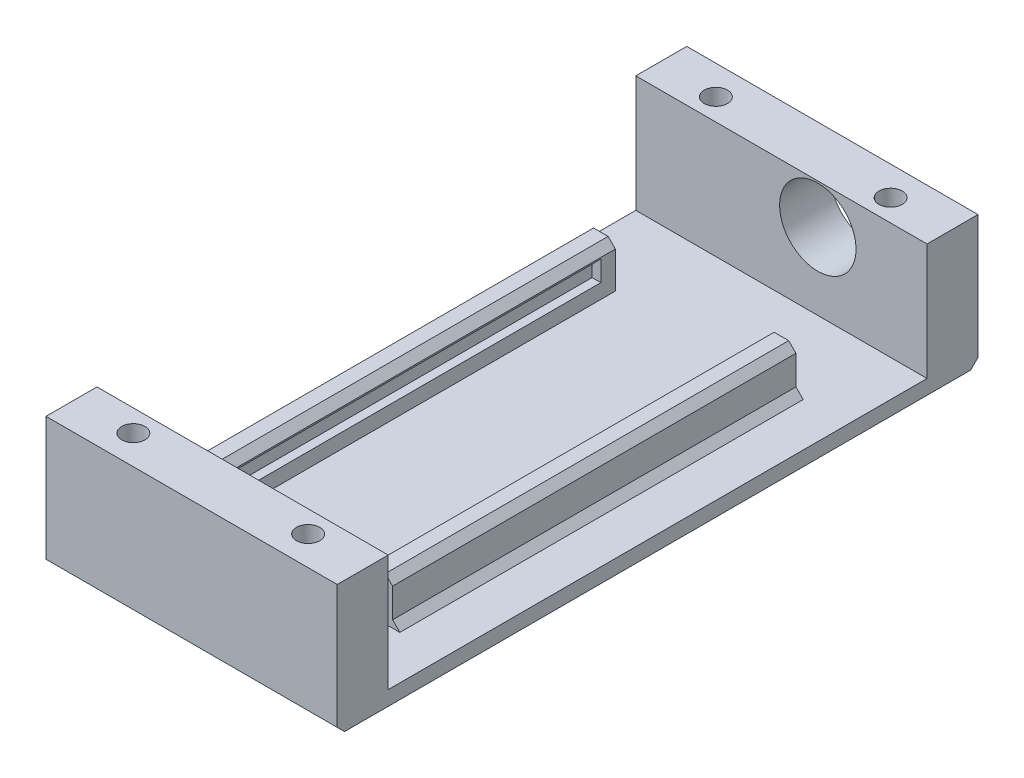
from build123d import *

# Parameters (mm, degrees)
CROQUIS1_W              = 40
CROQUIS1_H              = 88
CROQUIS1_R              = 1.6
SALIENTE_EXTRUIR1_DEPTH = 18
CROQUIS3_W              = 40
CROQUIS3_H              = 74
CORTAR_EXTRUIR1_DEPTH   = 16
CROQUIS4_W              = 4
CROQUIS4_H              = 55.4
SALIENTE_EXTRUIR2_DEPTH = 6
CORTAR_EXTRUIR2_START   = -2
CORTAR_EXTRUIR2_DEPTH   = 51.4
CORTAR_EXTRUIR3_REACH   = 94.022
CROQUIS6_R              = 5.25
CHAFL_N1_SIZE           = 1
CORTAR_EXTRUIR4_DEPTH   = 1
CHAFL_N2_SIZE           = 1
CROQUIS8_R              = 2.8
CORTAR_EXTRUIR5_DEPTH   = 3.5


with BuildPart() as part:
    # Croquis1 → Saliente-Extruir1 (new body)
    with BuildSketch(Plane(origin=(0, 0, 0), x_dir=(1, 0, 0), z_dir=(0, 1, 0))):
        Rectangle(CROQUIS1_W, CROQUIS1_H)
        with Locations(Location((-12, 40, 0), (0, 0, 270))):
            Circle(CROQUIS1_R, mode=Mode.SUBTRACT)
        with Locations(Location((12, 40, 0), (0, 0, 90))):
            Circle(CROQUIS1_R, mode=Mode.SUBTRACT)
        with Locations(Location((-12, -40, 0), (0, 0, 90))):
            Circle(CROQUIS1_R, mode=Mode.SUBTRACT)
        with Locations(Location((12, -40, 0), (0, 0, 270))):
            Circle(CROQUIS1_R, mode=Mode.SUBTRACT)
    extrude(amount=SALIENTE_EXTRUIR1_DEPTH)

    # Croquis3 → Cortar-Extruir1 (cut)
    with BuildSketch(Plane(origin=(0, 18, 0), x_dir=(1, 0, 0), z_dir=(0, 1, 0))):
        Rectangle(CROQUIS3_W, CROQUIS3_H)
    extrude(amount=-CORTAR_EXTRUIR1_DEPTH, mode=Mode.SUBTRACT)

    # Croquis4 → Saliente-Extruir2 (add)
    with BuildSketch(Plane(origin=(0, 2, 0), x_dir=(1, 0, 0), z_dir=(0, 1, 0))):
        with Locations((-13.8, -1.7)):
            Rectangle(CROQUIS4_W, CROQUIS4_H)
    saliente_extruir2 = extrude(amount=SALIENTE_EXTRUIR2_DEPTH)

    # Croquis5 → Cortar-Extruir2 (cut)
    with BuildSketch(Plane.XY.offset(29.4).offset(CORTAR_EXTRUIR2_START)):
        Polygon((-11.8, 4), (-13, 4), (-13, 5.6), (-11.8, 6.8), align=None)
    cortar_extruir2 = extrude(amount=-CORTAR_EXTRUIR2_DEPTH, mode=Mode.SUBTRACT)

    # Simetría1: Saliente-Extruir2, Cortar-Extruir2 across plane
    add(saliente_extruir2.mirror(Plane(origin=(-1.4, 0, 0), x_dir=(0, 0, 1), z_dir=(1, 0, 0))))
    add(cortar_extruir2.mirror(Plane(origin=(-1.4, 0, 0), x_dir=(0, 0, 1), z_dir=(1, 0, 0))), mode=Mode.SUBTRACT)

    # Croquis6 → Cortar-Extruir3 (cut, up to next)
    with BuildSketch(Plane(origin=(0, 0, -44), x_dir=(-1, 0, 0), z_dir=(0, 0, -1)), mode=Mode.PRIVATE) as cortar_extruir3_sk1:
        with Locations((-5, 12.5)):
            Circle(CROQUIS6_R)
    cortar_extruir3_tool1 = extrude(cortar_extruir3_sk1.sketch, amount=-CORTAR_EXTRUIR3_REACH, mode=Mode.PRIVATE) & part.part
    add(cortar_extruir3_tool1.solids().sort_by_distance((5, 12.5, -44))[0], mode=Mode.SUBTRACT)

    # Chaflán1
    chafl_n1_edges = [part.edges().sort_by_distance(p)[0] for p in [
        (-15.8, 2, 1.7),
        (-15.8, 8, 1.7),
        (-11.8, 8, 1.7),
        (13, 8, 1.7),
        (9, 8, 1.7),
        (13, 2, 1.7),
    ]]
    chamfer(chafl_n1_edges, length=CHAFL_N1_SIZE)

    # Croquis7 → Cortar-Extruir4 (cut)
    with BuildSketch(Plane(origin=(0, 0, -44), x_dir=(-1, 0, 0), z_dir=(0, 0, -1))):
        Polygon((13.349277552, 10.843260825), (12.702142135, 10.843260825), (12.702142135, 14.343260825), (13.016244699, 14.343260825), (13.016244699, 11.202235184), (13.554706238, 11.202235184), align=None)
        with BuildLine():
            Line((10.952142135, 11.920183902), (11.266244699, 11.920183902))
            add(Edge.make_bspline(
                [(11.266244699, 11.920183902), (11.264197895, 11.878512809), (11.260178025, 11.796671891), (11.241344805, 11.677350891), (11.214421773, 11.563285573), (11.176265555, 11.455453837), (11.12914596, 11.352567543), (11.07145794, 11.255992901), (11.004431311, 11.16477142), (10.928189034, 11.080630224), (10.845459137, 11.003714652), (10.756737301, 10.936591237), (10.662935418, 10.880527385), (10.564867085, 10.833404425), (10.461398114, 10.79807587), (10.353517551, 10.771851148), (10.240737789, 10.756075643), (10.163897853, 10.754379741), (10.124818417, 10.753517236)],
                knots=[0, 0, 0, 0, 1.100776268, 2.161895295, 3.184016182, 4.190939212, 5.176500551, 6.166955529, 7.155448256, 8.160289653, 9.16017456, 10.133824356, 11.091467644, 12.04088621, 13.000931625, 13.972173743, 14.968683325, 16, 16, 16, 16], degree=3))
            add(Edge.make_bspline(
                [(10.124818417, 10.753517236), (10.086437642, 10.754408401), (10.01102079, 10.756159509), (9.900996983, 10.771423682), (9.796007884, 10.794814665), (9.697243334, 10.829476418), (9.60368973, 10.872969336), (9.516505422, 10.927058477), (9.433582202, 10.989184526), (9.358989797, 11.062465248), (9.290467674, 11.140655962), (9.231405748, 11.224162988), (9.180541152, 11.310511825), (9.138910069, 11.400376981), (9.107351857, 11.494051102), (9.083970246, 11.590636102), (9.070604054, 11.691246638), (9.068563952, 11.759355152), (9.06752675, 11.793981979)],
                knots=[0, 0, 0, 0, 1.111674182, 2.184400057, 3.212814286, 4.223731311, 5.211378316, 6.196328225, 7.191884489, 8.207283132, 9.220262353, 10.201199469, 11.166417575, 12.120932471, 13.06540007, 14.026332106, 14.996573967, 16, 16, 16, 16], degree=3))
            add(Edge.make_bspline(
                [(9.06752675, 11.793981979), (9.06922004, 11.842729793), (9.072576904, 11.939369965), (9.10129089, 12.081385135), (9.146138886, 12.218977383), (9.200131458, 12.32971846), (9.254614612, 12.418943506), (9.303662739, 12.492443272), (9.36140823, 12.571561933), (9.427357734, 12.656619722), (9.502646994, 12.746502735), (9.585320007, 12.843044827), (9.67751183, 12.944460868), (9.742160462, 13.013774517), (9.775659763, 13.049691114)],
                knots=[0, 0, 0, 0, 1.184416499, 2.348048165, 3.509039915, 4.696071444, 5.333504901, 6.05069495, 6.844171097, 7.714965912, 8.667477798, 9.695072654, 10.805644396, 12, 12, 12, 12], degree=3))
            Line((9.775659763, 13.049691114), (10.651360885, 13.984286466))
            Line((10.651360885, 13.984286466), (9.022654955, 13.984286466))
            Line((9.022654955, 13.984286466), (9.022654955, 14.343260825))
            Line((9.022654955, 14.343260825), (11.400860084, 14.343260825))
            Line((11.400860084, 14.343260825), (10.043488289, 12.894743197))
            add(Edge.make_bspline(
                [(10.043488289, 12.894743197), (10.010438062, 12.860246772), (9.946955341, 12.7939862), (9.857203547, 12.697218484), (9.776462338, 12.607551149), (9.704678153, 12.524586855), (9.641791929, 12.448795933), (9.588004874, 12.379584429), (9.543079259, 12.317546294), (9.495467468, 12.244666486), (9.450066467, 12.155578956), (9.410163632, 12.047256962), (9.386006998, 11.935501368), (9.383094384, 11.860003118), (9.381629314, 11.822026851)],
                knots=[0, 0, 0, 0, 1.329530082, 2.553755191, 3.672934919, 4.687409497, 5.60679272, 6.413407421, 7.126401618, 7.737995624, 8.834647426, 9.90044882, 10.943907757, 12, 12, 12, 12], degree=3))
            add(Edge.make_bspline(
                [(9.381629314, 11.822026851), (9.382258526, 11.798142814), (9.383498582, 11.751071962), (9.394649978, 11.682104068), (9.411033592, 11.615318538), (9.436285803, 11.551541126), (9.466625403, 11.489517454), (9.505386481, 11.431133235), (9.549680213, 11.374398292), (9.601058771, 11.321258018), (9.65746288, 11.272573276), (9.717059065, 11.229450114), (9.780108664, 11.193410762), (9.846348922, 11.16386733), (9.915594355, 11.140691931), (9.98797911, 11.124633356), (10.063303123, 11.114550871), (10.114736619, 11.113186699), (10.140944218, 11.112491595)],
                knots=[0, 0, 0, 0, 0.991504627, 1.954065223, 2.895985987, 3.842598665, 4.797835564, 5.759220273, 6.74786863, 7.784730864, 8.824135544, 9.839918996, 10.835834653, 11.835434876, 12.84861661, 13.863796685, 14.911511676, 16, 16, 16, 16], degree=3))
            add(Edge.make_bspline(
                [(10.140944218, 11.112491595), (10.168322043, 11.113178196), (10.222087569, 11.114526567), (10.300857634, 11.124746109), (10.376527654, 11.140223083), (10.447931577, 11.1648623), (10.516563758, 11.193699284), (10.580673358, 11.231038105), (10.642061294, 11.273703483), (10.699493344, 11.323448604), (10.75180153, 11.379603353), (10.799386756, 11.440726805), (10.839706189, 11.507902554), (10.875497343, 11.5795187), (10.90287051, 11.657542834), (10.926272606, 11.740066779), (10.943271549, 11.82826796), (10.949136163, 11.889036378), (10.952142135, 11.920183902)],
                knots=[0, 0, 0, 0, 1.031072318, 2.024855787, 2.988461151, 3.935103592, 4.865765533, 5.788564469, 6.724086513, 7.67908574, 8.64457978, 9.611397706, 10.591395687, 11.591555111, 12.622101007, 13.700900657, 14.821571223, 16, 16, 16, 16], degree=3))
        make_face()
        Polygon((8.663680597, 10.843260825), (8.327142135, 10.843260825), (7.160475468, 13.601473966), (5.993808802, 10.843260825), (5.65727034, 10.843260825), (7.138039571, 14.343260825), (7.182911366, 14.343260825), align=None)
    extrude(amount=-CORTAR_EXTRUIR4_DEPTH, mode=Mode.SUBTRACT)

    # Chaflán2
    chafl_n2_edges = [part.edges().sort_by_distance(p)[0] for p in [
        (0, 0, 44),
        (0, 0, -44),
    ]]
    chamfer(chafl_n2_edges, length=CHAFL_N2_SIZE)

    # Croquis8 → Cortar-Extruir5 (cut)
    with BuildSketch(Plane.XZ):
        with Locations(Location((-12, 40, 0), (0, 0, 270))):
            Circle(CROQUIS8_R)
        with Locations(Location((12, 40, 0), (0, 0, 270))):
            Circle(CROQUIS8_R)
        with Locations(Location((-12, -40, 0), (0, 0, 270))):
            Circle(CROQUIS8_R)
        with Locations(Location((12, -40, 0), (0, 0, 270))):
            Circle(CROQUIS8_R)
    extrude(amount=-CORTAR_EXTRUIR5_DEPTH, mode=Mode.SUBTRACT)


solid = part.part
